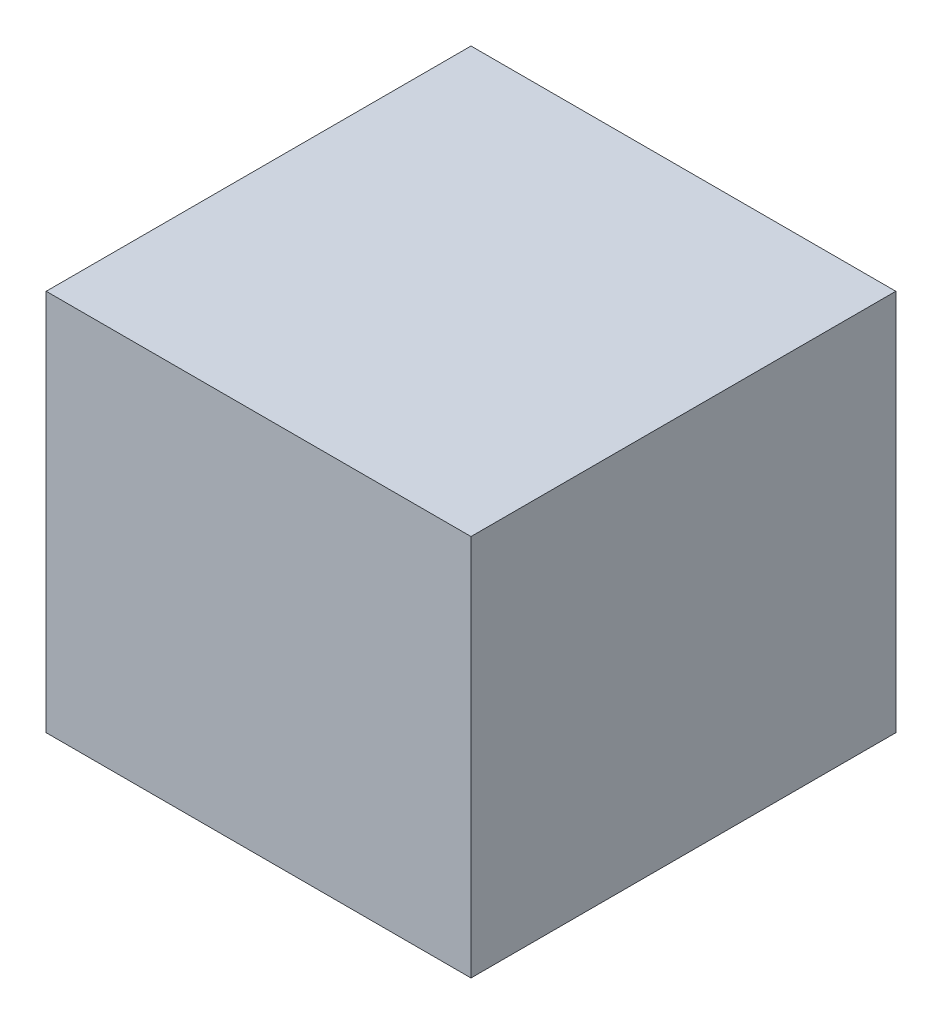
from build123d import *

# Parameters (mm, degrees)
SKETCH1_W           = 127
SKETCH1_H           = 127
BOSS_EXTRUDE1_DEPTH = 114.3


with BuildPart() as part:
    # Sketch1 → Boss-Extrude1 (new body)
    with BuildSketch(Plane(origin=(0, 0, 0), x_dir=(1, 0, 0), z_dir=(0, 1, 0))):
        Rectangle(SKETCH1_W, SKETCH1_H)
    extrude(amount=BOSS_EXTRUDE1_DEPTH)


solid = part.part
